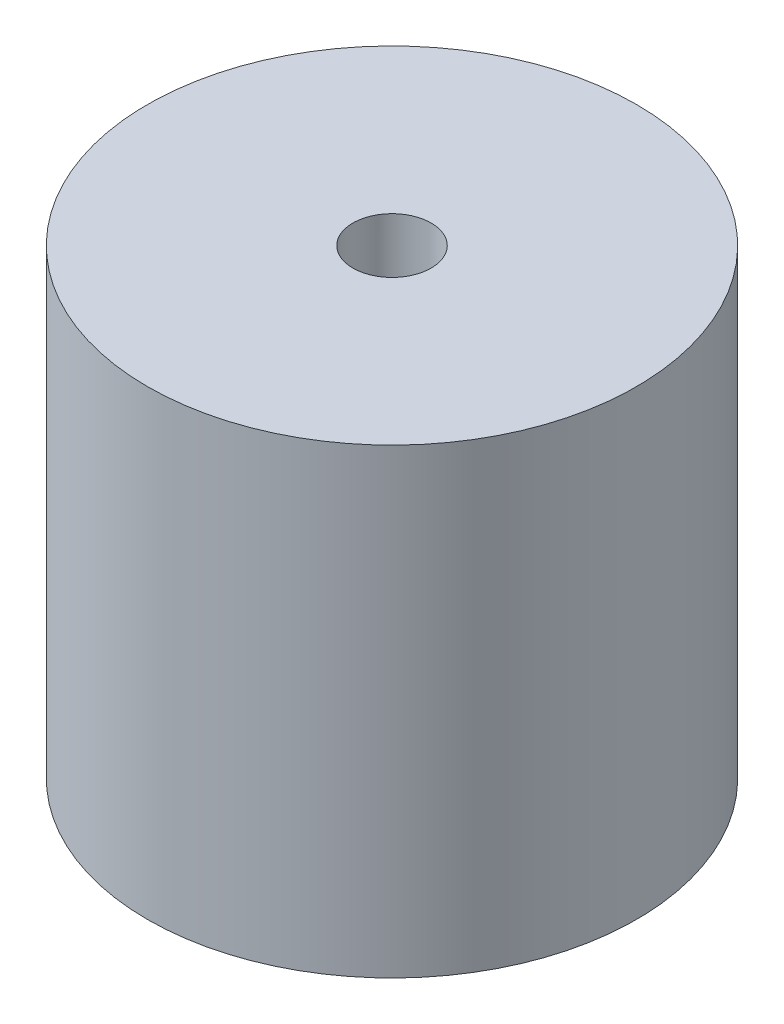
from build123d import *

# Parameters (mm, degrees)
SKETCH2_R           = 15.875
BOSS_EXTRUDE1_DEPTH = 29.972
SKETCH3_R           = 12.065
CUT_EXTRUDE1_DEPTH  = 24.13
CUT_EXTRUDE2_REACH  = 39.448
SKETCH4_R           = 2.54


with BuildPart() as part:
    # Sketch2 → Boss-Extrude1 (new body)
    with BuildSketch(Plane(origin=(0, 0, 0), x_dir=(1, 0, 0), z_dir=(0, 1, 0))):
        with Locations(Location((0, 0, 0), (0, 0, 270))):
            Circle(SKETCH2_R)
    extrude(amount=BOSS_EXTRUDE1_DEPTH)

    # Sketch3 → Cut-Extrude1 (cut)
    with BuildSketch(Plane.XZ):
        with Locations(Location((0, 0, 0), (0, 0, 270))):
            Circle(SKETCH3_R)
    extrude(amount=-CUT_EXTRUDE1_DEPTH, mode=Mode.SUBTRACT)

    # Sketch4 → Cut-Extrude2 (cut, up to next)
    with BuildSketch(Plane(origin=(0, 29.972, 0), x_dir=(1, 0, 0), z_dir=(0, 1, 0)), mode=Mode.PRIVATE) as cut_extrude2_sk1:
        with Locations(Location((0, 0, 0), (0, 0, 270))):
            Circle(SKETCH4_R)
    cut_extrude2_tool1 = extrude(cut_extrude2_sk1.sketch, amount=-CUT_EXTRUDE2_REACH, mode=Mode.PRIVATE) & part.part
    add(cut_extrude2_tool1.solids().sort_by_distance((0, 29.972, 0))[0], mode=Mode.SUBTRACT)


solid = part.part
